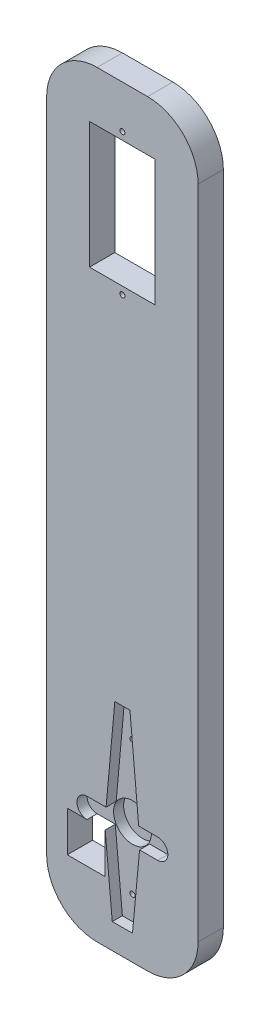
from build123d import *

# Parameters (mm, degrees)
SKICA1_W                 = 30
SKICA1_H                 = 150
P_IDAT_VYSUNUT_M1_DEPTH  = 5
ZAOBLIT1_R               = 10
SKICA2_W                 = 13
SKICA2_H                 = 25
ODEBRAT_VYSUNUT_M1_DEPTH = 154.05227865
SKICA3_R                 = 0.5
ODEBRAT_VYSUNUT_M2_DEPTH = 154.05227865
ODEBRAT_VYSUNUT_M3_DEPTH = 2
SKICA5_R                 = 0.5
ODEBRAT_VYSUNUT_M4_DEPTH = 154
SKICA6_R                 = 3.75
ODEBRAT_VYSUNUT_M5_DEPTH = 2
SKICA7_W                 = 7.5
SKICA7_H                 = 8
ODEBRAT_VYSUNUT_M6_DEPTH = 154.05227865


with BuildPart() as part:
    # Skica1 → Přidat vysunutím1 (new body)
    with BuildSketch(Plane.XY):
        with Locations((15, 75)):
            Rectangle(SKICA1_W, SKICA1_H)
    extrude(amount=P_IDAT_VYSUNUT_M1_DEPTH)

    # Zaoblit1
    zaoblit1_edges = [part.edges().sort_by_distance(p)[0] for p in [
        (0, 150, 2.5),
        (30, 150, 2.5),
        (30, 0, 2.5),
        (0, 0, 2.5),
    ]]
    fillet(zaoblit1_edges, radius=ZAOBLIT1_R)

    # Skica2 → Odebrat vysunutím1 (cut, through all)
    with BuildSketch(Plane.XY.offset(5)):
        with Locations((15, 127.5)):
            Rectangle(SKICA2_W, SKICA2_H)
    extrude(amount=-ODEBRAT_VYSUNUT_M1_DEPTH, mode=Mode.SUBTRACT)

    # Skica3 → Odebrat vysunutím2 (cut, through all)
    with BuildSketch(Plane.XY.offset(5)):
        with Locations((15, 141.5)):
            Circle(SKICA3_R)
        with Locations(Location((15, 113.5, 0), (0, 0, 180))):
            Circle(SKICA3_R)
    extrude(amount=-ODEBRAT_VYSUNUT_M2_DEPTH, mode=Mode.SUBTRACT)

    # Skica4 → Odebrat vysunutím3 (cut)
    with BuildSketch(Plane.XY.offset(5)):
        Polygon((18.40625, 20), (11.59375, 20), (13, 5), (17, 5), align=None)
        Polygon((18.5, 21), (11.5, 21), (11.59375, 20), (18.40625, 20), align=None)
        Polygon((11.59375, 20), (11.5, 21), (11.772727273, 24), (8, 24), (8, 20), align=None)
        Polygon((11.772727273, 24), (11.5, 21), (18.5, 21), (18.227272727, 24), align=None)
        Polygon((18.227272727, 24), (18.5, 21), (18.40625, 20), (22, 20), (22, 24), align=None)
        with BuildLine():
            ThreePointArc((22, 24), (24, 22), (22, 20))
            Line((22, 20), (22, 24))
        make_face()
        with BuildLine():
            Line((8, 24), (8, 20))
            ThreePointArc((8, 20), (6, 22), (8, 24))
        make_face()
        Polygon((13.5, 43), (11.772727273, 24), (18.227272727, 24), (16.5, 43), align=None)
    extrude(amount=-ODEBRAT_VYSUNUT_M3_DEPTH, mode=Mode.SUBTRACT)

    # Skica5 → Odebrat vysunutím4 (cut, through all)
    with BuildSketch(Plane.XY.offset(3)):
        with Locations((15, 36.2)):
            Circle(SKICA5_R)
        with Locations((15, 9.7)):
            Circle(SKICA5_R)
    extrude(amount=-ODEBRAT_VYSUNUT_M4_DEPTH, mode=Mode.SUBTRACT)

    # Skica6 → Odebrat vysunutím5 (cut)
    with BuildSketch(Plane.XY.offset(3)):
        with Locations((15, 22)):
            Circle(SKICA6_R)
    extrude(amount=-ODEBRAT_VYSUNUT_M5_DEPTH, mode=Mode.SUBTRACT)

    # Skica7 → Odebrat vysunutím6 (cut, through all)
    with BuildSketch(Plane.XY.offset(5)):
        with Locations((7.84375, 16)):
            Rectangle(SKICA7_W, SKICA7_H)
    extrude(amount=-ODEBRAT_VYSUNUT_M6_DEPTH, mode=Mode.SUBTRACT)


solid = part.part
